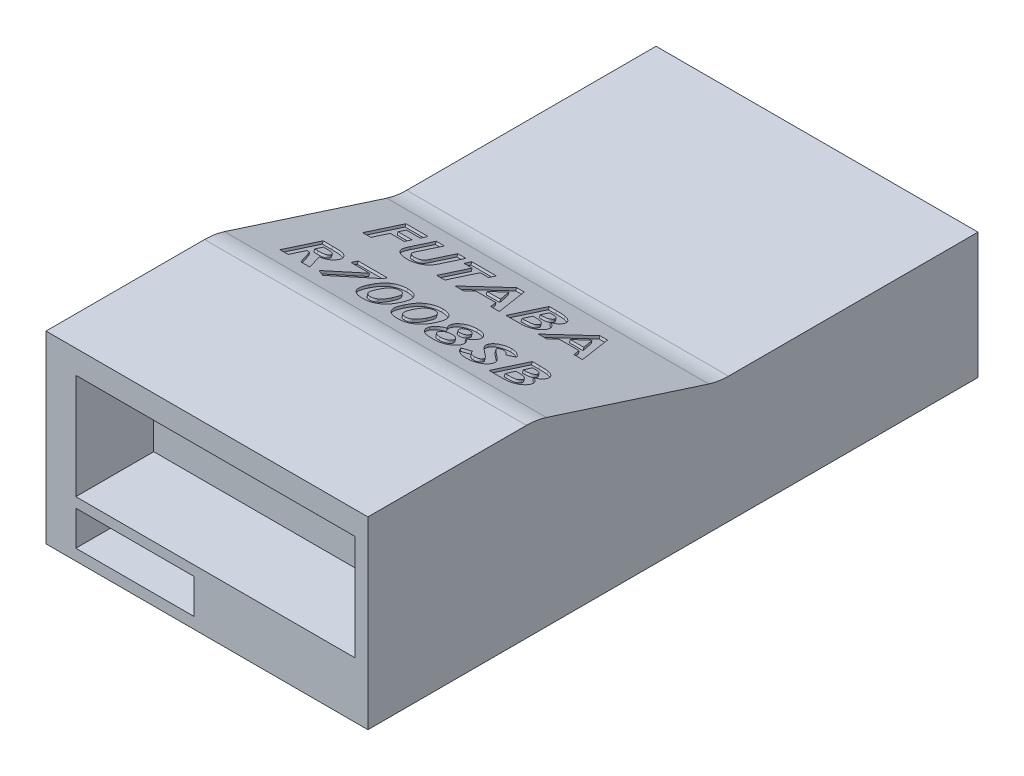
from build123d import *

# Parameters (mm, degrees)
EXTRUDE_1_DEPTH     = 12.4
SKETCH_2_W          = 21.5
SKETCH_2_H          = 8.1
SKETCH_2_W_2        = 9.1
SKETCH_2_H_2        = 2.67
CUT_EXTRUDE_1_DEPTH = 6
SKETCH_3_R          = 1.25
EXTRUDE_2_DEPTH     = 0.2
CUT_EXTRUDE_2_DEPTH = 0.2


with BuildPart() as part:
    # 草图1 → 凸台-拉伸1 (new, symmetric)
    with BuildSketch(Plane(origin=(0, 0, 0), x_dir=(0, 0, -1), z_dir=(1, 0, 0))):
        with BuildLine():
            Line((0, 0), (47, 0))
            Line((47, 0), (47, 9.7))
            Line((47, 9.7), (27.783823522, 9.7))
            ThreePointArc((27.783823522, 9.7), (27.00945734, 9.760328248), (26.25377762, 9.939857194))
            Line((26.25377762, 9.939857194), (13.74622238, 13.960142806))
            ThreePointArc((13.74622238, 13.960142806), (12.99054266, 14.139671752), (12.216176478, 14.2))
            Line((12.216176478, 14.2), (0, 14.2))
            Line((0, 14.2), (0, 0))
        make_face()
    extrude(amount=EXTRUDE_1_DEPTH, both=True)

    # 草图2 → 切除-拉伸1 (cut)
    with BuildSketch(Plane.XY):
        with Locations((0.65, 8.35)):
            Rectangle(SKETCH_2_W, SKETCH_2_H)
        with Locations((-5.55, 2.195)):
            Rectangle(SKETCH_2_W_2, SKETCH_2_H_2)
    extrude(amount=-CUT_EXTRUDE_1_DEPTH, mode=Mode.SUBTRACT)

    # 草图3 → 凸台-拉伸2 (add)
    with BuildSketch(Plane(origin=(0, 0, -47), x_dir=(-1, 0, 0), z_dir=(0, 0, -1))):
        with Locations(Location((7.4, 6.9, 0), (0, 0, 180))):
            Circle(SKETCH_3_R)
        with Locations(Location((1.4, 6.9, 0), (0, 0, 180))):
            Circle(SKETCH_3_R)
    extrude(amount=EXTRUDE_2_DEPTH)

    # 草图4 → 切除-拉伸2 (cut)
    # profile 1 of 13: a face of its own
    with BuildSketch(Plane(origin=(0, 16.657572254, -5.354219653), x_dir=(1, 0, 0), z_dir=(0, 0.9520285612852643, -0.30600918041312064))):
        Polygon((-9.496153846, 20.452658583), (-7.791025641, 20.452658583), (-7.791025641, 19.824453454), (-8.867948718, 19.824453454), (-8.867948718, 19.151376531), (-7.791025641, 19.151376531), (-7.791025641, 18.523171403), (-8.867948718, 18.523171403), (-8.867948718, 16.952658583), (-9.496153846, 16.952658583), align=None)
    # profile 2 of 13: a face of its own
    with BuildSketch(Plane(origin=(0, 16.657572254, -5.354219653), x_dir=(1, 0, 0), z_dir=(0, 0.9520285612852643, -0.30600918041312064))):
        with BuildLine():
            Line((-7.162820513, 20.452658583), (-6.534615385, 20.452658583))
            Line((-6.534615385, 20.452658583), (-6.534615385, 18.175414993))
            add(Edge.make_bspline(
                [(-6.534615385, 18.175414993), (-6.534581226, 18.151805519), (-6.534515249, 18.106204064), (-6.531212397, 18.040780907), (-6.52819006, 17.980643327), (-6.522736907, 17.925857162), (-6.51468073, 17.876398978), (-6.506879722, 17.831951071), (-6.496321829, 17.793309232), (-6.480455004, 17.749324702), (-6.456009435, 17.699905681), (-6.416066732, 17.648400043), (-6.369976269, 17.601393673), (-6.314734195, 17.562267351), (-6.252646989, 17.530617683), (-6.184055793, 17.507168782), (-6.109057296, 17.494134307), (-6.05719995, 17.492144355), (-6.030508814, 17.491120121)],
                knots=[0, 0, 0, 0, 1.155499968, 2.231836252, 3.205919964, 4.102923608, 4.924856345, 5.658536265, 6.31071849, 6.882491295, 7.94666036, 8.992281882, 10.060072772, 11.158554251, 12.289267114, 13.461410017, 14.693379945, 16, 16, 16, 16], degree=3))
            add(Edge.make_bspline(
                [(-6.030508814, 17.491120121), (-6.002152777, 17.491947571), (-5.946863304, 17.493560958), (-5.8673382, 17.509398096), (-5.79365774, 17.534616243), (-5.72738199, 17.570608966), (-5.668576907, 17.613752553), (-5.618799636, 17.662949762), (-5.579515596, 17.718298717), (-5.553911721, 17.769362343), (-5.539536406, 17.816361964), (-5.528761391, 17.858354342), (-5.520862113, 17.907901191), (-5.513695629, 17.96422873), (-5.509389124, 18.027920405), (-5.504719421, 18.098463999), (-5.503007932, 18.176342189), (-5.502716221, 18.230570234), (-5.502564103, 18.258848486)],
                knots=[0, 0, 0, 0, 1.261321664, 2.459363699, 3.594844139, 4.716940403, 5.803436589, 6.833651888, 7.818396249, 8.814403945, 9.360733334, 10.004355033, 10.743453831, 11.592799886, 12.532235708, 13.585170094, 14.740740724, 16, 16, 16, 16], degree=3))
            Line((-5.502564103, 18.258848486), (-5.502564103, 20.452658583))
            Line((-5.502564103, 20.452658583), (-4.874358974, 20.452658583))
            Line((-4.874358974, 20.452658583), (-4.874358974, 18.364717878))
            add(Edge.make_bspline(
                [(-4.874358974, 18.364717878), (-4.874446212, 18.322416299), (-4.874613962, 18.241074488), (-4.87719009, 18.124180582), (-4.8826742, 18.017416749), (-4.88728022, 17.920751794), (-4.896194447, 17.83431594), (-4.90548098, 17.757740081), (-4.917317464, 17.691295585), (-4.934929442, 17.6156566), (-4.965322502, 17.52856108), (-5.0143201, 17.428274365), (-5.076519378, 17.330087595), (-5.150035817, 17.235080894), (-5.2330426, 17.146822731), (-5.323699292, 17.069343487), (-5.420565581, 17.003804402), (-5.524653651, 16.951807985), (-5.635874918, 16.9112547), (-5.755329833, 16.884004934), (-5.882936937, 16.865594651), (-5.971077576, 16.863826117), (-6.016486378, 16.862914993)],
                knots=[0, 0, 0, 0, 1.170808336, 2.251350247, 3.235597562, 4.129743112, 4.929140599, 5.639994148, 6.264258765, 6.79612947, 7.788252245, 8.809469599, 9.879094798, 10.999557536, 12.129761673, 13.226370002, 14.293821979, 15.358369427, 16.438775801, 17.562147481, 18.744053101, 20, 20, 20, 20], degree=3))
            add(Edge.make_bspline(
                [(-6.016486378, 16.862914993), (-6.04665689, 16.863423175), (-6.10618269, 16.864425809), (-6.193725821, 16.873266417), (-6.278353455, 16.88629415), (-6.359906575, 16.90530027), (-6.438668239, 16.929852627), (-6.51461752, 16.960074869), (-6.587472173, 16.99579842), (-6.656824513, 17.0366947), (-6.722589197, 17.080916987), (-6.782694723, 17.129939254), (-6.839209464, 17.180136119), (-6.890500733, 17.233620079), (-6.936953772, 17.289829643), (-6.978472911, 17.348892202), (-7.014996468, 17.410802508), (-7.047443171, 17.476676492), (-7.075214382, 17.549862291), (-7.098626556, 17.632963152), (-7.119079982, 17.7272816), (-7.134279762, 17.833030128), (-7.148059971, 17.949860202), (-7.156782084, 18.078076182), (-7.161345014, 18.217681745), (-7.162316252, 18.314467388), (-7.162820513, 18.364717878)],
                knots=[0, 0, 0, 0, 1.001158378, 1.975264943, 2.917723546, 3.841610987, 4.75185031, 5.653588123, 6.552117133, 7.442167995, 8.324307438, 9.179605724, 10.014504199, 10.831958861, 11.636465792, 12.43274043, 13.225645099, 14.020104002, 14.867201867, 15.819789774, 16.883317127, 18.068162734, 19.364263498, 20.787406516, 22.332041935, 24, 24, 24, 24], degree=3))
            Line((-7.162820513, 18.364717878), (-7.162820513, 20.452658583))
        make_face()
    # profile 3 of 13: a face of its own
    with BuildSketch(Plane(origin=(0, 16.657572254, -5.354219653), x_dir=(1, 0, 0), z_dir=(0, 0.9520285612852643, -0.30600918041312064))):
        Polygon((-4.425641026, 20.452658583), (-2.541025641, 20.452658583), (-2.541025641, 19.824453454), (-3.169230769, 19.824453454), (-3.169230769, 16.952658583), (-3.797435897, 16.952658583), (-3.797435897, 19.824453454), (-4.425641026, 19.824453454), align=None)
    # profile 4 of 13: a face of its own
    with BuildSketch(Plane(origin=(0, 16.657572254, -5.354219653), x_dir=(1, 0, 0), z_dir=(0, 0.9520285612852643, -0.30600918041312064))):
        Polygon((-0.969811699, 20.452658583), (-0.387179487, 20.452658583), (1.026282051, 16.952658583), (0.355308494, 16.952658583), (0.083273237, 17.670607301), (-1.441666667, 17.670607301), (-1.713701923, 16.952658583), (-2.383974359, 16.952658583), align=None)
        Polygon((-0.678846154, 19.513856499), (-1.203285256, 18.298812429), (-0.154407051, 18.298812429), align=None, mode=Mode.SUBTRACT)
    # profile 5 of 13: a face of its own
    with BuildSketch(Plane(origin=(0, 16.657572254, -5.354219653), x_dir=(1, 0, 0), z_dir=(0, 0.9520285612852643, -0.30600918041312064))):
        with BuildLine():
            Line((1.542307692, 16.952658583), (1.542307692, 20.452658583))
            Line((1.542307692, 20.452658583), (2.103205128, 20.452658583))
            add(Edge.make_bspline(
                [(2.103205128, 20.452658583), (2.142471456, 20.452663064), (2.218451055, 20.452671735), (2.328069789, 20.448822285), (2.429731906, 20.44384259), (2.52311388, 20.43827147), (2.608374652, 20.428671316), (2.68538457, 20.418553802), (2.7542975, 20.406352705), (2.796902619, 20.395407942), (2.816947115, 20.390258743)],
                knots=[0, 0, 0, 0, 1.311965854, 2.538629056, 3.664479157, 4.713267157, 5.663616078, 6.530575999, 7.308677837, 8, 8, 8, 8], degree=3))
            add(Edge.make_bspline(
                [(2.816947115, 20.390258743), (2.843267574, 20.382995706), (2.894916763, 20.368743295), (2.968894884, 20.339959936), (3.039073451, 20.307965191), (3.105366778, 20.271465171), (3.167367798, 20.230019219), (3.224840886, 20.183298406), (3.279025593, 20.133178105), (3.327997945, 20.078261477), (3.372260882, 20.020231886), (3.410717439, 19.959104539), (3.444131258, 19.895814112), (3.470871065, 19.829564136), (3.491019007, 19.760659713), (3.505755128, 19.689395073), (3.51530613, 19.615544717), (3.516208574, 19.565301907), (3.516666667, 19.539798006)],
                knots=[0, 0, 0, 0, 1.099996261, 2.158545794, 3.195537121, 4.207578794, 5.205712374, 6.197378256, 7.190519799, 8.17788031, 9.159561366, 10.129234751, 11.085776129, 12.040971148, 13.00380137, 13.975669004, 14.972423361, 16, 16, 16, 16], degree=3))
            add(Edge.make_bspline(
                [(3.516666667, 19.539798006), (3.515468891, 19.507032187), (3.513111217, 19.442536698), (3.498050232, 19.347804494), (3.469808541, 19.258268944), (3.432854973, 19.172279943), (3.382609676, 19.090158231), (3.318807865, 19.011942853), (3.242482921, 18.935225442), (3.183937477, 18.889238529), (3.153485577, 18.865318839)],
                knots=[0, 0, 0, 0, 0.986156485, 1.941127874, 2.875419072, 3.804401753, 4.751181392, 5.761612777, 6.835722519, 8, 8, 8, 8], degree=3))
            add(Edge.make_bspline(
                [(3.153485577, 18.865318839), (3.178162336, 18.852721568), (3.226546632, 18.828021804), (3.295238118, 18.787422766), (3.358838936, 18.74424054), (3.417634253, 18.699343969), (3.470390769, 18.650829824), (3.51928689, 18.601493555), (3.561910334, 18.548508401), (3.600025503, 18.493762852), (3.633154588, 18.436464186), (3.662006368, 18.376709169), (3.686376432, 18.314293664), (3.707013632, 18.249535315), (3.722404862, 18.182211385), (3.73244027, 18.112297795), (3.740124007, 18.040032985), (3.740721729, 17.990808002), (3.741025641, 17.965779576)],
                knots=[0, 0, 0, 0, 1.164658916, 2.283573913, 3.35186032, 4.395461096, 5.390182219, 6.362969632, 7.312859996, 8.245001507, 9.165155236, 10.092416118, 11.032087915, 11.979892451, 12.947605196, 13.931445124, 14.948243989, 16, 16, 16, 16], degree=3))
            add(Edge.make_bspline(
                [(3.741025641, 17.965779576), (3.739053457, 17.917976714), (3.735161359, 17.823637957), (3.706704238, 17.685126996), (3.657368633, 17.553806041), (3.591121088, 17.43019702), (3.509491367, 17.317878209), (3.415640597, 17.219487906), (3.310513639, 17.136202699), (3.213521314, 17.079991645), (3.129630591, 17.042268772), (3.060145473, 17.018946112), (2.985519929, 16.997340036), (2.904386998, 16.982167803), (2.81821751, 16.968280507), (2.726171307, 16.959706203), (2.628420421, 16.953895608), (2.561280887, 16.953079261), (2.526682692, 16.952658583)],
                knots=[0, 0, 0, 0, 1.284142165, 2.534249414, 3.780121997, 5.041676246, 6.291546858, 7.49970053, 8.684500223, 9.883330709, 10.50184324, 11.153274765, 11.851151195, 12.587658647, 13.369265475, 14.195992086, 15.070362669, 16, 16, 16, 16], degree=3))
            Line((2.526682692, 16.952658583), (1.542307692, 16.952658583))
        make_face()
        with BuildLine():
            Line((2.170512821, 19.824453454), (2.170512821, 19.061632942))
            Line((2.170512821, 19.061632942), (2.337379808, 19.061632942))
            add(Edge.make_bspline(
                [(2.337379808, 19.061632942), (2.36005853, 19.061830709), (2.403838432, 19.062212486), (2.467073857, 19.067129645), (2.525872589, 19.075518624), (2.580011619, 19.08722336), (2.629995271, 19.102086668), (2.675504234, 19.119970429), (2.716338415, 19.141790561), (2.763778289, 19.17429261), (2.813925657, 19.222120831), (2.858069821, 19.291218605), (2.884070439, 19.370680783), (2.886966206, 19.426723663), (2.888461538, 19.45566339)],
                knots=[0, 0, 0, 0, 1.065314748, 2.056525647, 2.977365736, 3.853934255, 4.656397591, 5.425096493, 6.14721249, 6.826394842, 8.123232004, 9.372140726, 10.643011755, 12, 12, 12, 12], degree=3))
            add(Edge.make_bspline(
                [(2.888461538, 19.45566339), (2.887264999, 19.482770253), (2.884951538, 19.535180283), (2.858772259, 19.608768632), (2.818110663, 19.67398297), (2.770103934, 19.718616851), (2.724896269, 19.749100476), (2.686186693, 19.769172645), (2.643700027, 19.787141046), (2.596613773, 19.800880123), (2.545196822, 19.811189442), (2.489698932, 19.818760403), (2.430024352, 19.823913521), (2.388806993, 19.824269616), (2.367528045, 19.824453454)],
                knots=[0, 0, 0, 0, 1.347982417, 2.606269829, 3.849316587, 5.153353503, 5.842674298, 6.568177932, 7.326619318, 8.142485038, 9.012069166, 9.942760135, 10.937925643, 12, 12, 12, 12], degree=3))
            Line((2.367528045, 19.824453454), (2.170512821, 19.824453454))
        make_face(mode=Mode.SUBTRACT)
        with BuildLine():
            Line((2.170512821, 18.478299608), (2.170512821, 17.580863711))
            Line((2.170512821, 17.580863711), (2.351402244, 17.580863711))
            add(Edge.make_bspline(
                [(2.351402244, 17.580863711), (2.387164313, 17.581068018), (2.455921354, 17.581460825), (2.554415693, 17.58620686), (2.64397167, 17.594760753), (2.724351997, 17.6054396), (2.795679791, 17.619907766), (2.857713947, 17.638302186), (2.911305182, 17.658539251), (2.956132162, 17.68353443), (2.992753236, 17.712622619), (3.025799917, 17.742351448), (3.05274412, 17.77664646), (3.074062877, 17.814035466), (3.092514224, 17.853589696), (3.103642773, 17.896853729), (3.112115659, 17.942545323), (3.112581945, 17.97414921), (3.112820513, 17.990318839)],
                knots=[0, 0, 0, 0, 1.753078804, 3.370512758, 4.83203934, 6.162291463, 7.344201807, 8.395507345, 9.331626367, 10.147333109, 10.898971645, 11.62040215, 12.321813352, 13.025280112, 13.727906689, 14.453419512, 15.208716525, 16, 16, 16, 16], degree=3))
            add(Edge.make_bspline(
                [(3.112820513, 17.990318839), (3.112294403, 18.008809065), (3.111269681, 18.04482305), (3.102900771, 18.097461333), (3.087691728, 18.146602663), (3.068535196, 18.19350365), (3.041877864, 18.236485075), (3.010196535, 18.277034362), (2.971917403, 18.313778388), (2.928870285, 18.348939567), (2.878660084, 18.379725085), (2.821263243, 18.406436975), (2.756367951, 18.428745761), (2.683773187, 18.446508032), (2.603797202, 18.461582625), (2.515856259, 18.470583821), (2.42068276, 18.477278407), (2.354687907, 18.477951473), (2.320552885, 18.478299608)],
                knots=[0, 0, 0, 0, 0.845221588, 1.646264278, 2.427170338, 3.19324141, 3.95557735, 4.731569926, 5.540061037, 6.376114724, 7.268642756, 8.224665384, 9.265483498, 10.400594375, 11.639216012, 12.983232105, 14.439614077, 16, 16, 16, 16], degree=3))
            Line((2.320552885, 18.478299608), (2.170512821, 18.478299608))
        make_face(mode=Mode.SUBTRACT)
    # profile 6 of 13: a face of its own
    with BuildSketch(Plane(origin=(0, 16.657572254, -5.354219653), x_dir=(1, 0, 0), z_dir=(0, 0.9520285612852643, -0.30600918041312064))):
        Polygon((5.446854968, 20.452658583), (6.029487179, 20.452658583), (7.442948718, 16.952658583), (6.77197516, 16.952658583), (6.499939904, 17.670607301), (4.975, 17.670607301), (4.702964744, 16.952658583), (4.032692308, 16.952658583), align=None)
        Polygon((5.737820513, 19.513856499), (5.21338141, 18.298812429), (6.262259615, 18.298812429), align=None, mode=Mode.SUBTRACT)
    # profile 7 of 13: a face of its own
    with BuildSketch(Plane(origin=(0, 16.657572254, -5.354219653), x_dir=(1, 0, 0), z_dir=(0, 0.9520285612852643, -0.30600918041312064))):
        with BuildLine():
            Line((-9.496153846, 13.753940634), (-8.764182692, 13.753940634))
            add(Edge.make_bspline(
                [(-8.764182692, 13.753940634), (-8.715799622, 13.753768902), (-8.622745349, 13.753438613), (-8.488566169, 13.748227523), (-8.36530414, 13.740975864), (-8.252776761, 13.72990964), (-8.151032173, 13.715237164), (-8.059968404, 13.697940743), (-7.979588115, 13.678227764), (-7.909213411, 13.653663836), (-7.845703721, 13.625956097), (-7.786503859, 13.594119398), (-7.730307791, 13.558508249), (-7.677491125, 13.518185625), (-7.627594872, 13.47387692), (-7.5805249, 13.425537533), (-7.536946351, 13.372757566), (-7.497129066, 13.315870521), (-7.460838815, 13.256026654), (-7.428765845, 13.193143799), (-7.402684052, 13.127178226), (-7.379637993, 13.059083279), (-7.363038663, 12.987885528), (-7.351494071, 12.914278095), (-7.343041573, 12.838001874), (-7.342555595, 12.786183196), (-7.342307692, 12.759749929)],
                knots=[0, 0, 0, 0, 1.749336639, 3.364467119, 4.854658419, 6.213483162, 7.451590619, 8.570285859, 9.5643256, 10.440900261, 11.26203566, 12.067320669, 12.869050712, 13.665104639, 14.467235401, 15.27997916, 16.102287765, 16.939272006, 17.78853747, 18.631303466, 19.488103222, 20.351255419, 21.228522269, 22.127379805, 23.044756219, 24, 24, 24, 24], degree=3))
            add(Edge.make_bspline(
                [(-7.342307692, 12.759749929), (-7.342951654, 12.73215967), (-7.344214347, 12.678060202), (-7.351015895, 12.598592495), (-7.36344699, 12.522563351), (-7.38227569, 12.450195375), (-7.403916836, 12.380587863), (-7.432694008, 12.315025116), (-7.465171892, 12.25255362), (-7.503744925, 12.194057058), (-7.546076944, 12.138236103), (-7.595308193, 12.087229465), (-7.648249241, 12.038295728), (-7.707876098, 11.994499937), (-7.771560358, 11.952880779), (-7.840567358, 11.915162737), (-7.914446736, 11.880397669), (-7.966387598, 11.861010265), (-7.992948718, 11.851096083)],
                knots=[0, 0, 0, 0, 1.099860209, 2.156625411, 3.176576793, 4.16617041, 5.135385252, 6.078461593, 7.016046972, 7.938469504, 8.868247731, 9.803980173, 10.76021508, 11.73834243, 12.748633912, 13.790971185, 14.870363756, 16, 16, 16, 16], degree=3))
            Line((-7.992948718, 11.851096083), (-7.18525641, 10.253940634))
            Line((-7.18525641, 10.253940634), (-7.883573718, 10.253940634))
            Line((-7.883573718, 10.253940634), (-8.654807692, 11.77958166))
            Line((-8.654807692, 11.77958166), (-8.867948718, 11.77958166))
            Line((-8.867948718, 11.77958166), (-8.867948718, 10.253940634))
            Line((-8.867948718, 10.253940634), (-9.496153846, 10.253940634))
            Line((-9.496153846, 10.253940634), (-9.496153846, 13.753940634))
        make_face()
        with BuildLine():
            Line((-8.867948718, 12.407786788), (-8.623257212, 12.407786788))
            add(Edge.make_bspline(
                [(-8.623257212, 12.407786788), (-8.593341641, 12.408123717), (-8.536059751, 12.408768864), (-8.45368087, 12.411761324), (-8.3788612, 12.418971674), (-8.31127944, 12.428081681), (-8.250595524, 12.4386005), (-8.197350732, 12.453674606), (-8.150724642, 12.469826892), (-8.111269776, 12.489899994), (-8.077560445, 12.512727465), (-8.048454596, 12.538660039), (-8.024379885, 12.568673692), (-8.004565169, 12.601952781), (-7.989151475, 12.638791653), (-7.97790066, 12.678785899), (-7.971613117, 12.722391106), (-7.970889714, 12.752484636), (-7.970512821, 12.76816339)],
                knots=[0, 0, 0, 0, 1.688639943, 3.233382647, 4.650958383, 5.928841754, 7.082724185, 8.122798841, 9.049171256, 9.863274652, 10.613301712, 11.341792392, 12.054588806, 12.776240173, 13.521029143, 14.301969904, 15.115324896, 16, 16, 16, 16], degree=3))
            add(Edge.make_bspline(
                [(-7.970512821, 12.76816339), (-7.971225372, 12.786712501), (-7.972625049, 12.823148793), (-7.986514186, 12.875604277), (-8.008622693, 12.924155416), (-8.0389274, 12.968582844), (-8.077092239, 13.007530994), (-8.120889403, 13.041864099), (-8.17126414, 13.06901215), (-8.217907356, 13.086918715), (-8.26034178, 13.097632397), (-8.298637509, 13.105616139), (-8.342984193, 13.111274446), (-8.393415313, 13.117276087), (-8.449802317, 13.121167848), (-8.512452548, 13.124008057), (-8.581186076, 13.125170127), (-8.629099873, 13.12554162), (-8.654106571, 13.125735506)],
                knots=[0, 0, 0, 0, 1.020303359, 2.004196876, 2.966617323, 3.9489082, 4.950758222, 5.960522915, 7.003732012, 8.091992268, 8.70421221, 9.413913587, 10.24622431, 11.166358409, 12.212345909, 13.359657661, 14.621978493, 16, 16, 16, 16], degree=3))
            Line((-8.654106571, 13.125735506), (-8.867948718, 13.125735506))
            Line((-8.867948718, 13.125735506), (-8.867948718, 12.407786788))
        make_face(mode=Mode.SUBTRACT)
    # profile 8 of 13: a face of its own
    with BuildSketch(Plane(origin=(0, 16.657572254, -5.354219653), x_dir=(1, 0, 0), z_dir=(0, 0.9520285612852643, -0.30600918041312064))):
        Polygon((-6.803846154, 13.753940634), (-4.56025641, 13.753940634), (-4.56025641, 13.427918999), (-6.104126603, 10.164197044), (-6.660817308, 10.444645762), (-5.370753205, 13.170607301), (-6.803846154, 13.170607301), align=None)
    # profile 9 of 13: a face of its own
    with BuildSketch(Plane(origin=(0, 16.657572254, -5.354219653), x_dir=(1, 0, 0), z_dir=(0, 0.9520285612852643, -0.30600918041312064))):
        with BuildLine():
            add(Edge.make_bspline(
                [(-3.067568109, 13.843684224), (-3.037160373, 13.843232812), (-2.977370641, 13.842345217), (-2.889311619, 13.832731835), (-2.804486435, 13.818208697), (-2.722563241, 13.797953983), (-2.644131729, 13.771147591), (-2.568621058, 13.739060799), (-2.496930023, 13.700010589), (-2.428144335, 13.655901372), (-2.36229049, 13.605963484), (-2.30095124, 13.549031714), (-2.243006398, 13.486416064), (-2.189710259, 13.417169897), (-2.139882561, 13.341923081), (-2.093687031, 13.260663683), (-2.051477308, 13.172993995), (-2.01278032, 13.078755808), (-1.978177351, 12.976536533), (-1.949031313, 12.865163671), (-1.924033709, 12.744611787), (-1.902933967, 12.61458081), (-1.886985972, 12.474897898), (-1.876236703, 12.325655848), (-1.868860045, 12.167142378), (-1.868258014, 12.05840344), (-1.867948718, 12.00253839)],
                knots=[0, 0, 0, 0, 0.879237366, 1.728815576, 2.559023295, 3.367336655, 4.166867292, 4.954216142, 5.737608147, 6.525189134, 7.316157332, 8.124696809, 8.942788509, 9.781158001, 10.649253743, 11.551476218, 12.482711956, 13.461909668, 14.496590415, 15.601789533, 16.789733467, 18.056700938, 19.410929216, 20.8549011, 22.384193279, 24, 24, 24, 24], degree=3))
            add(Edge.make_bspline(
                [(-1.867948718, 12.00253839), (-1.868282983, 11.945974406), (-1.868932455, 11.836071599), (-1.875930053, 11.676108284), (-1.887980247, 11.525782648), (-1.903511408, 11.385110242), (-1.924784849, 11.254165353), (-1.949699006, 11.132608923), (-1.979305105, 11.020485011), (-2.015047885, 10.918046259), (-2.053510639, 10.823642569), (-2.095835825, 10.736143815), (-2.141285719, 10.655313003), (-2.188817839, 10.579930689), (-2.241038071, 10.512219105), (-2.295404707, 10.449875705), (-2.35428497, 10.395275227), (-2.415199772, 10.345603809), (-2.480380668, 10.302677736), (-2.549155466, 10.2651353), (-2.6227503, 10.234683925), (-2.699823662, 10.208198946), (-2.781689283, 10.189185588), (-2.867046329, 10.174099114), (-2.956858464, 10.165761403), (-3.018006184, 10.164727055), (-3.049338942, 10.164197044)],
                knots=[0, 0, 0, 0, 1.643780988, 3.193836972, 4.651895693, 6.025988579, 7.305620092, 8.505800249, 9.631074763, 10.672816429, 11.65661981, 12.592235626, 13.49536222, 14.350718032, 15.179365177, 15.97804903, 16.751647189, 17.51006938, 18.259804725, 19.016521909, 19.783502495, 20.571750527, 21.382245291, 22.22305063, 23.089471752, 24, 24, 24, 24], degree=3))
            add(Edge.make_bspline(
                [(-3.049338942, 10.164197044), (-3.080670855, 10.164737279), (-3.142049612, 10.165795591), (-3.232104608, 10.17403712), (-3.317914004, 10.189246704), (-3.400427314, 10.208344916), (-3.479070257, 10.234625324), (-3.554219925, 10.265987782), (-3.625298482, 10.303295972), (-3.692502733, 10.346322059), (-3.755603224, 10.395661138), (-3.815580535, 10.450785472), (-3.872301994, 10.511555335), (-3.924904727, 10.578651399), (-3.974250214, 10.651178073), (-4.019823859, 10.729963575), (-4.061598275, 10.814893195), (-4.100880172, 10.906085318), (-4.135011168, 11.005503204), (-4.16538617, 11.114034643), (-4.190268572, 11.232584334), (-4.210280665, 11.361114191), (-4.226258309, 11.499351919), (-4.238143839, 11.64736424), (-4.245180306, 11.805220096), (-4.245822966, 11.913722288), (-4.246153846, 11.969585666)],
                knots=[0, 0, 0, 0, 0.917216111, 1.796812873, 2.643793957, 3.46689424, 4.273913431, 5.068098542, 5.848489301, 6.620921603, 7.401012384, 8.190319798, 9.003608147, 9.831726257, 10.68377682, 11.569763213, 12.493818149, 13.453288342, 14.474581811, 15.568529029, 16.750744269, 18.018426408, 19.375425659, 20.823733699, 22.36466933, 24, 24, 24, 24], degree=3))
            add(Edge.make_bspline(
                [(-4.246153846, 11.969585666), (-4.245554488, 12.047203431), (-4.24439802, 12.196967909), (-4.229742399, 12.413334036), (-4.208231666, 12.61332704), (-4.176637494, 12.796612382), (-4.137571737, 12.963868899), (-4.087546001, 13.11399479), (-4.030595339, 13.249067386), (-3.98206606, 13.329085205), (-3.95869391, 13.367622525)],
                knots=[0, 0, 0, 0, 1.288568992, 2.486310467, 3.599230591, 4.627010532, 5.572937695, 6.447898582, 7.252493626, 8, 8, 8, 8], degree=3))
            add(Edge.make_bspline(
                [(-3.95869391, 13.367622525), (-3.931517888, 13.405481576), (-3.87838341, 13.479503482), (-3.785476291, 13.576680408), (-3.685659687, 13.659790873), (-3.576883423, 13.726954014), (-3.46086784, 13.779918872), (-3.336616887, 13.817327355), (-3.2045894, 13.839123281), (-3.113923923, 13.842141206), (-3.067568109, 13.843684224)],
                knots=[0, 0, 0, 0, 1.058512271, 2.069600068, 3.047294572, 4.004278952, 4.967380941, 5.939006123, 6.946246673, 8, 8, 8, 8], degree=3))
        make_face()
        with BuildLine():
            add(Edge.make_bspline(
                [(-3.052143429, 13.215479095), (-3.079632275, 13.214176179), (-3.133525003, 13.211621771), (-3.21172592, 13.189938449), (-3.285464501, 13.15644739), (-3.341555471, 13.116146137), (-3.383539004, 13.077512552), (-3.4128732, 13.042550415), (-3.441161408, 13.003535189), (-3.466146978, 12.958706319), (-3.489739878, 12.909674558), (-3.512797253, 12.856217332), (-3.531698246, 12.797021615), (-3.55026797, 12.733095519), (-3.566536782, 12.662671656), (-3.580166479, 12.58517439), (-3.592343416, 12.500099748), (-3.600836974, 12.407392006), (-3.608755519, 12.30714816), (-3.614431908, 12.199144905), (-3.616805063, 12.083411377), (-3.617559417, 12.003707415), (-3.617948718, 11.962574448)],
                knots=[0, 0, 0, 0, 1.076674018, 2.110852608, 3.161083442, 4.239746716, 4.804137807, 5.395870207, 6.026861976, 6.692161227, 7.405688833, 8.16177676, 8.973626916, 9.841385931, 10.773283133, 11.807421078, 12.927755683, 14.143907515, 15.458935494, 16.872852025, 18.386167141, 20, 20, 20, 20], degree=3))
            add(Edge.make_bspline(
                [(-3.617948718, 11.962574448), (-3.617307976, 11.909284701), (-3.616079306, 11.80709766), (-3.609644107, 11.660149137), (-3.596745284, 11.526414149), (-3.580701753, 11.404986323), (-3.558167959, 11.296653152), (-3.53224137, 11.200389704), (-3.500224338, 11.117423104), (-3.463222488, 11.046553468), (-3.422241272, 10.986264815), (-3.377754359, 10.935019189), (-3.331276369, 10.890642895), (-3.281356574, 10.854596578), (-3.228114066, 10.826972342), (-3.171993323, 10.80710257), (-3.112958681, 10.794939456), (-3.072532367, 10.793252823), (-3.052143429, 10.792402172)],
                knots=[0, 0, 0, 0, 1.771748488, 3.397459088, 4.888034009, 6.237357457, 7.467047327, 8.564189669, 9.548206622, 10.417051504, 11.216568818, 11.965764335, 12.669334354, 13.348544111, 14.005342236, 14.656555988, 15.322436492, 16, 16, 16, 16], degree=3))
            add(Edge.make_bspline(
                [(-3.052143429, 10.792402172), (-3.032454176, 10.79298425), (-2.993905066, 10.794123887), (-2.937691831, 10.805822103), (-2.884532601, 10.824840861), (-2.834587881, 10.851744229), (-2.787679026, 10.885955978), (-2.744035297, 10.927626449), (-2.703985846, 10.977171), (-2.680652855, 11.013940383), (-2.668629808, 11.032886948)],
                knots=[0, 0, 0, 0, 0.992283464, 1.942767638, 2.88273346, 3.832339453, 4.79467288, 5.803907806, 6.868395428, 8, 8, 8, 8], degree=3))
            add(Edge.make_bspline(
                [(-2.668629808, 11.032886948), (-2.654474695, 11.058776823), (-2.62479257, 11.113065791), (-2.590444365, 11.204676401), (-2.56153196, 11.307998028), (-2.536647476, 11.423352219), (-2.519628007, 11.551193944), (-2.50497086, 11.690712549), (-2.497901355, 11.842610592), (-2.496751461, 11.947846104), (-2.496153846, 12.00253839)],
                knots=[0, 0, 0, 0, 0.710965849, 1.490837728, 2.352621235, 3.297892224, 4.334225155, 5.461620853, 6.680770821, 8, 8, 8, 8], degree=3))
            add(Edge.make_bspline(
                [(-2.496153846, 12.00253839), (-2.496384692, 12.057705432), (-2.49682903, 12.163892569), (-2.504981357, 12.316336697), (-2.516334096, 12.455569107), (-2.532939874, 12.58127895), (-2.554306227, 12.693771395), (-2.580640337, 12.793039088), (-2.611686293, 12.879277667), (-2.648503098, 12.952401139), (-2.689279997, 13.014546059), (-2.73256592, 13.067861581), (-2.778543897, 13.113381028), (-2.827137039, 13.151275698), (-2.879470051, 13.180230069), (-2.934543304, 13.200674249), (-2.992469701, 13.213042293), (-3.031983705, 13.214655864), (-3.052143429, 13.215479095)],
                knots=[0, 0, 0, 0, 1.793836731, 3.452829483, 4.963243077, 6.335886805, 7.574563692, 8.684454726, 9.672768357, 10.54971625, 11.340229787, 12.085688095, 12.778991901, 13.440269426, 14.083255152, 14.715733572, 15.344777694, 16, 16, 16, 16], degree=3))
        make_face(mode=Mode.SUBTRACT)
    # profile 10 of 13: a face of its own
    with BuildSketch(Plane(origin=(0, 16.657572254, -5.354219653), x_dir=(1, 0, 0), z_dir=(0, 0.9520285612852643, -0.30600918041312064))):
        with BuildLine():
            add(Edge.make_bspline(
                [(-0.375260417, 13.843684224), (-0.344852681, 13.843232812), (-0.285062949, 13.842345217), (-0.197003927, 13.832731835), (-0.112178743, 13.818208697), (-0.030255549, 13.797953983), (0.048175964, 13.771147591), (0.123686635, 13.739060799), (0.195377669, 13.700010589), (0.264163357, 13.655901372), (0.330017202, 13.605963484), (0.391356453, 13.549031714), (0.449301294, 13.486416064), (0.502597434, 13.417169897), (0.552425131, 13.341923081), (0.598620661, 13.260663683), (0.640830385, 13.172993995), (0.679527373, 13.078755808), (0.714130341, 12.976536533), (0.743276379, 12.865163671), (0.768273984, 12.744611787), (0.789373726, 12.61458081), (0.80532172, 12.474897898), (0.81607099, 12.325655848), (0.823447647, 12.167142378), (0.824049678, 12.05840344), (0.824358974, 12.00253839)],
                knots=[0, 0, 0, 0, 0.879237366, 1.728815576, 2.559023295, 3.367336655, 4.166867292, 4.954216142, 5.737608147, 6.525189134, 7.316157332, 8.124696809, 8.942788509, 9.781158001, 10.649253743, 11.551476218, 12.482711956, 13.461909668, 14.496590415, 15.601789533, 16.789733467, 18.056700938, 19.410929216, 20.8549011, 22.384193279, 24, 24, 24, 24], degree=3))
            add(Edge.make_bspline(
                [(0.824358974, 12.00253839), (0.824024709, 11.945974406), (0.823375237, 11.836071599), (0.816377639, 11.676108284), (0.804327445, 11.525782648), (0.788796284, 11.385110242), (0.767522843, 11.254165353), (0.742608686, 11.132608923), (0.713002587, 11.020485011), (0.677259807, 10.918046259), (0.638797053, 10.823642569), (0.596471868, 10.736143815), (0.551021973, 10.655313003), (0.503489853, 10.579930689), (0.451269622, 10.512219105), (0.396902985, 10.449875705), (0.338022722, 10.395275227), (0.277107921, 10.345603809), (0.211927024, 10.302677736), (0.143152227, 10.2651353), (0.069557393, 10.234683925), (-0.007515969, 10.208198946), (-0.08938159, 10.189185588), (-0.174738637, 10.174099114), (-0.264550772, 10.165761403), (-0.325698491, 10.164727055), (-0.35703125, 10.164197044)],
                knots=[0, 0, 0, 0, 1.643780988, 3.193836972, 4.651895693, 6.025988579, 7.305620092, 8.505800249, 9.631074763, 10.672816429, 11.65661981, 12.592235626, 13.49536222, 14.350718032, 15.179365177, 15.97804903, 16.751647189, 17.51006938, 18.259804725, 19.016521909, 19.783502495, 20.571750527, 21.382245291, 22.22305063, 23.089471752, 24, 24, 24, 24], degree=3))
            add(Edge.make_bspline(
                [(-0.35703125, 10.164197044), (-0.388363163, 10.164737279), (-0.44974192, 10.165795591), (-0.539796916, 10.17403712), (-0.625606312, 10.189246704), (-0.708119621, 10.208344916), (-0.786762565, 10.234625324), (-0.861912233, 10.265987782), (-0.93299079, 10.303295972), (-1.000195041, 10.346322059), (-1.063295532, 10.395661138), (-1.123272843, 10.450785472), (-1.179994302, 10.511555335), (-1.232597035, 10.578651399), (-1.281942521, 10.651178073), (-1.327516167, 10.729963575), (-1.369290582, 10.814893195), (-1.408572479, 10.906085318), (-1.442703475, 11.005503204), (-1.473078477, 11.114034643), (-1.49796088, 11.232584334), (-1.517972973, 11.361114191), (-1.533950617, 11.499351919), (-1.545836147, 11.64736424), (-1.552872614, 11.805220096), (-1.553515274, 11.913722288), (-1.553846154, 11.969585666)],
                knots=[0, 0, 0, 0, 0.917216111, 1.796812873, 2.643793957, 3.46689424, 4.273913431, 5.068098542, 5.848489301, 6.620921603, 7.401012384, 8.190319798, 9.003608147, 9.831726257, 10.68377682, 11.569763213, 12.493818149, 13.453288342, 14.474581811, 15.568529029, 16.750744269, 18.018426408, 19.375425659, 20.823733699, 22.36466933, 24, 24, 24, 24], degree=3))
            add(Edge.make_bspline(
                [(-1.553846154, 11.969585666), (-1.553246796, 12.047203431), (-1.552090327, 12.196967909), (-1.537434707, 12.413334036), (-1.515923973, 12.61332704), (-1.484329801, 12.796612382), (-1.445264044, 12.963868899), (-1.395238308, 13.11399479), (-1.338287647, 13.249067386), (-1.289758367, 13.329085205), (-1.266386218, 13.367622525)],
                knots=[0, 0, 0, 0, 1.288568992, 2.486310467, 3.599230591, 4.627010532, 5.572937695, 6.447898582, 7.252493626, 8, 8, 8, 8], degree=3))
            add(Edge.make_bspline(
                [(-1.266386218, 13.367622525), (-1.239210196, 13.405481576), (-1.186075718, 13.479503482), (-1.093168598, 13.576680408), (-0.993351994, 13.659790873), (-0.88457573, 13.726954014), (-0.768560148, 13.779918872), (-0.644309194, 13.817327355), (-0.512281708, 13.839123281), (-0.42161623, 13.842141206), (-0.375260417, 13.843684224)],
                knots=[0, 0, 0, 0, 1.058512271, 2.069600068, 3.047294572, 4.004278952, 4.967380941, 5.939006123, 6.946246673, 8, 8, 8, 8], degree=3))
        make_face()
        with BuildLine():
            add(Edge.make_bspline(
                [(-0.359835737, 13.215479095), (-0.387324582, 13.214176179), (-0.441217311, 13.211621771), (-0.519418227, 13.189938449), (-0.593156809, 13.15644739), (-0.649247779, 13.116146137), (-0.691231312, 13.077512552), (-0.720565507, 13.042550415), (-0.748853715, 13.003535189), (-0.773839285, 12.958706319), (-0.797432186, 12.909674558), (-0.820489561, 12.856217332), (-0.839390554, 12.797021615), (-0.857960278, 12.733095519), (-0.87422909, 12.662671656), (-0.887858787, 12.58517439), (-0.900035723, 12.500099748), (-0.908529282, 12.407392006), (-0.916447827, 12.30714816), (-0.922124215, 12.199144905), (-0.924497371, 12.083411377), (-0.925251725, 12.003707415), (-0.925641026, 11.962574448)],
                knots=[0, 0, 0, 0, 1.076674018, 2.110852608, 3.161083442, 4.239746716, 4.804137807, 5.395870207, 6.026861976, 6.692161227, 7.405688833, 8.16177676, 8.973626916, 9.841385931, 10.773283133, 11.807421078, 12.927755683, 14.143907515, 15.458935494, 16.872852025, 18.386167141, 20, 20, 20, 20], degree=3))
            add(Edge.make_bspline(
                [(-0.925641026, 11.962574448), (-0.925000284, 11.909284701), (-0.923771614, 11.80709766), (-0.917336415, 11.660149137), (-0.904437592, 11.526414149), (-0.888394061, 11.404986323), (-0.865860267, 11.296653152), (-0.839933678, 11.200389704), (-0.807916645, 11.117423104), (-0.770914795, 11.046553468), (-0.729933579, 10.986264815), (-0.685446666, 10.935019189), (-0.638968677, 10.890642895), (-0.589048882, 10.854596578), (-0.535806374, 10.826972342), (-0.479685631, 10.80710257), (-0.420650989, 10.794939456), (-0.380224674, 10.793252823), (-0.359835737, 10.792402172)],
                knots=[0, 0, 0, 0, 1.771748488, 3.397459088, 4.888034009, 6.237357457, 7.467047327, 8.564189669, 9.548206622, 10.417051504, 11.216568818, 11.965764335, 12.669334354, 13.348544111, 14.005342236, 14.656555988, 15.322436492, 16, 16, 16, 16], degree=3))
            add(Edge.make_bspline(
                [(-0.359835737, 10.792402172), (-0.340146484, 10.79298425), (-0.301597374, 10.794123887), (-0.245384138, 10.805822103), (-0.192224909, 10.824840861), (-0.142280189, 10.851744229), (-0.095371334, 10.885955978), (-0.051727605, 10.927626449), (-0.011678154, 10.977171), (0.011654837, 11.013940383), (0.023677885, 11.032886948)],
                knots=[0, 0, 0, 0, 0.992283464, 1.942767638, 2.88273346, 3.832339453, 4.79467288, 5.803907806, 6.868395428, 8, 8, 8, 8], degree=3))
            add(Edge.make_bspline(
                [(0.023677885, 11.032886948), (0.037832998, 11.058776823), (0.067515122, 11.113065791), (0.101863327, 11.204676401), (0.130775732, 11.307998028), (0.155660217, 11.423352219), (0.172679686, 11.551193944), (0.187336832, 11.690712549), (0.194406338, 11.842610592), (0.195556231, 11.947846104), (0.196153846, 12.00253839)],
                knots=[0, 0, 0, 0, 0.710965849, 1.490837728, 2.352621235, 3.297892224, 4.334225155, 5.461620853, 6.680770821, 8, 8, 8, 8], degree=3))
            add(Edge.make_bspline(
                [(0.196153846, 12.00253839), (0.195923, 12.057705432), (0.195478662, 12.163892569), (0.187326335, 12.316336697), (0.175973597, 12.455569107), (0.159367818, 12.58127895), (0.138001466, 12.693771395), (0.111667356, 12.793039088), (0.080621399, 12.879277667), (0.043804594, 12.952401139), (0.003027695, 13.014546059), (-0.040258228, 13.067861581), (-0.086236205, 13.113381028), (-0.134829347, 13.151275698), (-0.187162359, 13.180230069), (-0.242235611, 13.200674249), (-0.300162009, 13.213042293), (-0.339676013, 13.214655864), (-0.359835737, 13.215479095)],
                knots=[0, 0, 0, 0, 1.793836731, 3.452829483, 4.963243077, 6.335886805, 7.574563692, 8.684454726, 9.672768357, 10.54971625, 11.340229787, 12.085688095, 12.778991901, 13.440269426, 14.083255152, 14.715733572, 15.344777694, 16, 16, 16, 16], degree=3))
        make_face(mode=Mode.SUBTRACT)
    # profile 11 of 13: a face of its own
    with BuildSketch(Plane(origin=(0, 16.657572254, -5.354219653), x_dir=(1, 0, 0), z_dir=(0, 0.9520285612852643, -0.30600918041312064))):
        with BuildLine():
            add(Edge.make_bspline(
                [(3.037099359, 12.138556019), (3.073801267, 12.112331513), (3.146449384, 12.060422472), (3.242390971, 11.967425482), (3.325030126, 11.863686262), (3.393499047, 11.749841126), (3.448354281, 11.628688418), (3.487622306, 11.501523115), (3.512564905, 11.369466848), (3.515289381, 11.279559257), (3.516666667, 11.234108903)],
                knots=[0, 0, 0, 0, 1.013736912, 2.006600758, 2.994453809, 3.989973287, 4.987781207, 5.978959008, 6.978317308, 8, 8, 8, 8], degree=3))
            add(Edge.make_bspline(
                [(3.516666667, 11.234108903), (3.515005077, 11.184894169), (3.511709526, 11.087283062), (3.482572455, 10.944136387), (3.435794056, 10.806613717), (3.371862245, 10.676232953), (3.291703512, 10.55704583), (3.198271054, 10.451531261), (3.091447091, 10.362444939), (2.991990956, 10.302000445), (2.906385587, 10.26184831), (2.837302804, 10.236151749), (2.764355928, 10.213529524), (2.687024417, 10.195455866), (2.605322335, 10.181346411), (2.51936628, 10.172028553), (2.429099669, 10.165255037), (2.367541657, 10.164555655), (2.335977564, 10.164197044)],
                knots=[0, 0, 0, 0, 1.313679292, 2.605514271, 3.884962679, 5.186178731, 6.472827995, 7.711026938, 8.938935107, 10.174644318, 10.808706728, 11.462743532, 12.142127587, 12.847854939, 13.582806024, 14.355735269, 15.156897313, 16, 16, 16, 16], degree=3))
            add(Edge.make_bspline(
                [(2.335977564, 10.164197044), (2.30231759, 10.164653627), (2.236586297, 10.165545244), (2.140633251, 10.17093643), (2.050121182, 10.180875686), (1.964860226, 10.193959947), (1.884932412, 10.211274217), (1.810335374, 10.233227763), (1.740888988, 10.258224317), (1.655882964, 10.296283716), (1.558736493, 10.355721618), (1.453738726, 10.442766712), (1.361577551, 10.546440138), (1.281452137, 10.663831799), (1.218294265, 10.794219502), (1.17132819, 10.933510801), (1.143514324, 11.081328234), (1.140165845, 11.182575908), (1.138461538, 11.234108903)],
                knots=[0, 0, 0, 0, 0.886964665, 1.7320671, 2.531131818, 3.285397207, 4.004107883, 4.684213108, 5.332925796, 5.947568694, 7.135706876, 8.320776993, 9.52873045, 10.778999824, 12.05415135, 13.333578234, 14.642845846, 16, 16, 16, 16], degree=3))
            add(Edge.make_bspline(
                [(1.138461538, 11.234108903), (1.140018989, 11.279062964), (1.143079569, 11.367403137), (1.165002916, 11.49684943), (1.202594795, 11.619579832), (1.254176703, 11.736448742), (1.320690698, 11.847469164), (1.402530104, 11.951824206), (1.498657281, 12.050455297), (1.571552316, 12.108701996), (1.608914263, 12.138556019)],
                knots=[0, 0, 0, 0, 1.01821053, 2.000906977, 2.963938143, 3.919209931, 4.888045165, 5.887808425, 6.917407893, 8, 8, 8, 8], degree=3))
            add(Edge.make_bspline(
                [(1.608914263, 12.138556019), (1.585751838, 12.165270487), (1.540151998, 12.217863231), (1.481145357, 12.30250706), (1.431434746, 12.389774937), (1.389228071, 12.478958636), (1.358027821, 12.571593679), (1.33443324, 12.666223653), (1.321088167, 12.763812621), (1.319002292, 12.829590485), (1.317948718, 12.862814833)],
                knots=[0, 0, 0, 0, 1.061529281, 2.089831458, 3.092927091, 4.075998741, 5.048384512, 6.024008542, 7.00192825, 8, 8, 8, 8], degree=3))
            add(Edge.make_bspline(
                [(1.317948718, 12.862814833), (1.319345597, 12.907790805), (1.322101585, 12.996526666), (1.346511209, 13.126279446), (1.387037114, 13.249570448), (1.442169158, 13.366038694), (1.512178285, 13.473145884), (1.595364285, 13.56919709), (1.69289659, 13.650673994), (1.801148234, 13.720584774), (1.920661827, 13.77619116), (2.050303435, 13.815100344), (2.188507617, 13.839731909), (2.283753814, 13.842346744), (2.332471955, 13.843684224)],
                knots=[0, 0, 0, 0, 1.022455555, 2.017265428, 2.990720743, 3.968117071, 4.939886797, 5.893155559, 6.847550415, 7.820889576, 8.817530429, 9.83499769, 10.892607882, 12, 12, 12, 12], degree=3))
            add(Edge.make_bspline(
                [(2.332471955, 13.843684224), (2.380488428, 13.842344555), (2.474110495, 13.839732481), (2.609885924, 13.815264125), (2.736725952, 13.775488232), (2.853581705, 13.718707747), (2.960713816, 13.648662222), (3.056588485, 13.564348368), (3.139513445, 13.465904851), (3.210103693, 13.35602683), (3.266353273, 13.237649182), (3.307938389, 13.113505643), (3.331991711, 12.984571992), (3.335443314, 12.897032127), (3.337179487, 12.852999128)],
                knots=[0, 0, 0, 0, 1.094655142, 2.134348324, 3.136019022, 4.118575226, 5.088726318, 6.048298823, 7.020513804, 8.015920439, 9.020015034, 10.003048569, 10.995523219, 12, 12, 12, 12], degree=3))
            add(Edge.make_bspline(
                [(3.337179487, 12.852999128), (3.336343131, 12.821878985), (3.334701843, 12.760808031), (3.322566497, 12.67083328), (3.302132062, 12.584502386), (3.273641833, 12.499729086), (3.23403069, 12.414209617), (3.180427602, 12.32630527), (3.115226486, 12.232363602), (3.064020791, 12.1708807), (3.037099359, 12.138556019)],
                knots=[0, 0, 0, 0, 0.940746401, 1.846144481, 2.739104268, 3.619506754, 4.545839139, 5.581956076, 6.728711598, 8, 8, 8, 8], degree=3))
        make_face()
        with BuildLine():
            add(Edge.make_bspline(
                [(2.317047276, 13.215479095), (2.291182759, 13.214232186), (2.240870559, 13.211806673), (2.169080941, 13.189913726), (2.104539732, 13.154106254), (2.048720212, 13.104828126), (2.002945297, 13.0450365), (1.969303249, 12.976293808), (1.949353117, 12.899448411), (1.947241007, 12.845639808), (1.946153846, 12.817943038)],
                knots=[0, 0, 0, 0, 1.018099191, 1.980427864, 2.929421084, 3.909248076, 4.895556904, 5.880788387, 6.909183412, 8, 8, 8, 8], degree=3))
            add(Edge.make_bspline(
                [(1.946153846, 12.817943038), (1.947496822, 12.790009731), (1.950119112, 12.735467259), (1.97074048, 12.657145412), (2.005890171, 12.586163546), (2.054150458, 12.524004238), (2.112794523, 12.473234313), (2.178457898, 12.43445907), (2.251868803, 12.412323289), (2.302882336, 12.409321599), (2.328966346, 12.407786788)],
                knots=[0, 0, 0, 0, 1.07118507, 2.091592095, 3.082435519, 4.092579768, 5.090825648, 6.043203473, 6.999459622, 8, 8, 8, 8], degree=3))
            add(Edge.make_bspline(
                [(2.328966346, 12.407786788), (2.355543488, 12.408976003), (2.407320746, 12.411292817), (2.480914948, 12.43400296), (2.547213919, 12.470323204), (2.603989191, 12.521671994), (2.651016559, 12.583853814), (2.685265504, 12.656076151), (2.70497796, 12.736982041), (2.707609642, 12.793527831), (2.708974359, 12.82285089)],
                knots=[0, 0, 0, 0, 1.008803858, 1.965339183, 2.900766489, 3.864508618, 4.855158575, 5.849593072, 6.884859315, 8, 8, 8, 8], degree=3))
            add(Edge.make_bspline(
                [(2.708974359, 12.82285089), (2.707575121, 12.850529351), (2.704869042, 12.904058521), (2.685465427, 12.980908903), (2.649829718, 13.048578686), (2.603008992, 13.107999018), (2.544308351, 13.15591782), (2.476161206, 13.191157596), (2.399069364, 13.211597008), (2.344980037, 13.214157044), (2.317047276, 13.215479095)],
                knots=[0, 0, 0, 0, 1.065910571, 2.061433587, 3.023559535, 3.990682701, 4.956464619, 5.918590567, 6.925120432, 8, 8, 8, 8], degree=3))
        make_face(mode=Mode.SUBTRACT)
        with BuildLine():
            add(Edge.make_bspline(
                [(2.337379808, 11.77958166), (2.317724732, 11.779255258), (2.278984825, 11.778611924), (2.222033978, 11.77119332), (2.167383787, 11.760137764), (2.115102055, 11.744886937), (2.065452906, 11.724096223), (2.01801548, 11.699032632), (1.972953604, 11.669442804), (1.930935672, 11.635863942), (1.89296128, 11.599007942), (1.858730821, 11.560568329), (1.830752252, 11.519551334), (1.807452776, 11.477320376), (1.788731514, 11.433540796), (1.776355346, 11.387491637), (1.768386826, 11.339786143), (1.767243426, 11.307291095), (1.766666667, 11.290899769)],
                knots=[0, 0, 0, 0, 1.129580664, 2.226389355, 3.296443603, 4.333934503, 5.352185725, 6.386189251, 7.41493955, 8.447544828, 9.47401038, 10.455044306, 11.4018853, 12.322125673, 13.225630306, 14.132028716, 15.057747923, 16, 16, 16, 16], degree=3))
            add(Edge.make_bspline(
                [(1.766666667, 11.290899769), (1.766941561, 11.273805234), (1.767486778, 11.239900339), (1.775721531, 11.190413407), (1.78757812, 11.142686659), (1.804231079, 11.097166847), (1.826501247, 11.053880472), (1.853092232, 11.012406698), (1.88493125, 10.973036345), (1.921154998, 10.935980503), (1.961707323, 10.902549519), (2.005413842, 10.873096239), (2.051697292, 10.84712872), (2.101947069, 10.828425884), (2.154302223, 10.811307406), (2.210165366, 10.800922037), (2.268926348, 10.793280195), (2.309073426, 10.792699862), (2.329667468, 10.792402172)],
                knots=[0, 0, 0, 0, 0.973817353, 1.931446211, 2.852767904, 3.776304432, 4.688323523, 5.623710549, 6.581246645, 7.570897993, 8.57436511, 9.572506873, 10.574556662, 11.591826551, 12.624694332, 13.712108235, 14.826391851, 16, 16, 16, 16], degree=3))
            add(Edge.make_bspline(
                [(2.329667468, 10.792402172), (2.35048498, 10.792779514), (2.391051719, 10.793514835), (2.450352134, 10.800013673), (2.506439802, 10.81032544), (2.559247729, 10.825073668), (2.60897561, 10.843966735), (2.654956387, 10.868013871), (2.698239879, 10.895265968), (2.737435165, 10.927104567), (2.77322335, 10.961801995), (2.804059896, 10.999827425), (2.83027987, 11.039958098), (2.851429136, 11.082627623), (2.868494694, 11.127634586), (2.880200596, 11.175427752), (2.887464529, 11.225470037), (2.888125634, 11.259557597), (2.888461538, 11.276877333)],
                knots=[0, 0, 0, 0, 1.200705402, 2.339794563, 3.437264955, 4.487414319, 5.499029866, 6.500076882, 7.476298407, 8.444948224, 9.407950986, 10.347155707, 11.263432813, 12.167927724, 13.089546445, 14.03463663, 15.00140776, 16, 16, 16, 16], degree=3))
            add(Edge.make_bspline(
                [(2.888461538, 11.276877333), (2.887820159, 11.294423499), (2.886566484, 11.328720173), (2.879706562, 11.379367279), (2.866838047, 11.427381528), (2.850002271, 11.473876489), (2.827606823, 11.517890029), (2.799803359, 11.559329255), (2.768156193, 11.599220667), (2.731167647, 11.635788445), (2.690726425, 11.669224391), (2.647683189, 11.699012149), (2.602170519, 11.724239632), (2.554063922, 11.744861847), (2.503187627, 11.7601457), (2.449929824, 11.771192931), (2.394377873, 11.778613584), (2.356568148, 11.779255758), (2.337379808, 11.77958166)],
                knots=[0, 0, 0, 0, 1.011708178, 1.977538892, 2.938094892, 3.871441737, 4.823268678, 5.775953079, 6.743660653, 7.753304209, 8.767430709, 9.76505158, 10.765940967, 11.761741361, 12.775867861, 13.822051386, 14.89469657, 16, 16, 16, 16], degree=3))
        make_face(mode=Mode.SUBTRACT)
    # profile 12 of 13: a face of its own
    with BuildSketch(Plane(origin=(0, 16.657572254, -5.354219653), x_dir=(1, 0, 0), z_dir=(0, 0.9520285612852643, -0.30600918041312064))):
        with BuildLine():
            Line((5.894871795, 13.286292397), (5.425120192, 12.856504736))
            add(Edge.make_bspline(
                [(5.425120192, 12.856504736), (5.404998048, 12.884889113), (5.366366337, 12.939383158), (5.303748362, 13.012351968), (5.24141314, 13.074599794), (5.178783173, 13.125866592), (5.115303331, 13.165840878), (5.051083807, 13.194143115), (4.98648868, 13.212135115), (4.943090725, 13.214375552), (4.921714744, 13.215479095)],
                knots=[0, 0, 0, 0, 1.299362458, 2.494594718, 3.587462134, 4.587049575, 5.512617175, 6.380583204, 7.202344345, 8, 8, 8, 8], degree=3))
            add(Edge.make_bspline(
                [(4.921714744, 13.215479095), (4.901775841, 13.21477984), (4.863279059, 13.21342976), (4.808399039, 13.200010071), (4.759675777, 13.176849659), (4.717156823, 13.146565471), (4.683475538, 13.110080046), (4.656583643, 13.071816217), (4.641441247, 13.029581602), (4.63944821, 13.000573166), (4.638461538, 12.986212269)],
                knots=[0, 0, 0, 0, 1.185010067, 2.2879431, 3.333075148, 4.379039566, 5.372662701, 6.27520591, 7.14612461, 8, 8, 8, 8], degree=3))
            add(Edge.make_bspline(
                [(4.638461538, 12.986212269), (4.639079836, 12.971644281), (4.640325, 12.942306379), (4.652351594, 12.899308029), (4.670479105, 12.857293636), (4.687800682, 12.831717475), (4.696654647, 12.81864416)],
                knots=[0, 0, 0, 0, 0.967525499, 1.948461899, 2.951351359, 4, 4, 4, 4], degree=3))
            add(Edge.make_bspline(
                [(4.696654647, 12.81864416), (4.70470386, 12.808482408), (4.723232084, 12.785091398), (4.758561614, 12.748043683), (4.802928082, 12.702656991), (4.858038806, 12.650492035), (4.921605987, 12.58967276), (4.996576045, 12.522589995), (5.080791017, 12.447166265), (5.140649067, 12.39464391), (5.172015224, 12.367121724)],
                knots=[0, 0, 0, 0, 0.473873513, 1.090794244, 1.870441696, 2.795289791, 3.865433203, 5.087734844, 6.473946851, 8, 8, 8, 8], degree=3))
            add(Edge.make_bspline(
                [(5.172015224, 12.367121724), (5.201456875, 12.34164146), (5.257331011, 12.293285214), (5.33682881, 12.224651286), (5.406694136, 12.162903015), (5.467944766, 12.10896711), (5.519652201, 12.06227766), (5.562033819, 12.022611489), (5.595607238, 11.990740825), (5.614691762, 11.971490925), (5.622836538, 11.96327557)],
                knots=[0, 0, 0, 0, 1.543621617, 2.929473131, 4.163658386, 5.240097082, 6.164993805, 6.925417477, 7.541396219, 8, 8, 8, 8], degree=3))
            add(Edge.make_bspline(
                [(5.622836538, 11.96327557), (5.653736123, 11.929835602), (5.713135976, 11.865552239), (5.790334845, 11.765933244), (5.853872011, 11.668684793), (5.903025567, 11.571976997), (5.94014831, 11.474414556), (5.966320336, 11.373604756), (5.981994936, 11.268494198), (5.983735183, 11.196769073), (5.984615385, 11.160491115)],
                knots=[0, 0, 0, 0, 1.206664779, 2.319633467, 3.337109185, 4.282041471, 5.190008762, 6.099243693, 7.03861361, 8, 8, 8, 8], degree=3))
            add(Edge.make_bspline(
                [(5.984615385, 11.160491115), (5.983988879, 11.125142693), (5.982759653, 11.055787775), (5.967703985, 10.954297182), (5.946235487, 10.857166281), (5.913041422, 10.765451991), (5.872584692, 10.677648852), (5.821866339, 10.595124557), (5.762304587, 10.517043926), (5.694037674, 10.444802746), (5.618526362, 10.379248882), (5.537533304, 10.320891284), (5.450266508, 10.272709654), (5.357471568, 10.233035518), (5.259198156, 10.202477968), (5.155563344, 10.179893091), (5.046408616, 10.166338003), (4.97176704, 10.16492098), (4.933633814, 10.164197044)],
                knots=[0, 0, 0, 0, 1.043214005, 2.046824704, 3.02475056, 3.976699089, 4.921714032, 5.875962561, 6.831408892, 7.817874052, 8.806269674, 9.781291748, 10.760897367, 11.74438705, 12.757449933, 13.795994037, 14.874007457, 16, 16, 16, 16], degree=3))
            add(Edge.make_bspline(
                [(4.933633814, 10.164197044), (4.903699556, 10.164728098), (4.844412559, 10.165779889), (4.757032487, 10.174366885), (4.67265715, 10.188225384), (4.59138159, 10.208088753), (4.512839644, 10.233258336), (4.437028088, 10.264002017), (4.364470274, 10.300796312), (4.294617195, 10.342884584), (4.227808424, 10.391754611), (4.163199189, 10.446407263), (4.101431251, 10.507683121), (4.042207951, 10.57543727), (3.985908216, 10.649861574), (3.930689154, 10.729919536), (3.879004866, 10.817096924), (3.847077183, 10.878252567), (3.830769231, 10.909489512)],
                knots=[0, 0, 0, 0, 1.016823716, 2.013894106, 2.979844003, 3.91962641, 4.853723003, 5.779685073, 6.695824784, 7.614987388, 8.547259901, 9.504950863, 10.487499108, 11.500346958, 12.559593716, 13.656357062, 14.802919212, 16, 16, 16, 16], degree=3))
            Line((3.830769231, 10.909489512), (4.383253205, 11.241120121))
            add(Edge.make_bspline(
                [(4.383253205, 11.241120121), (4.403652016, 11.205662107), (4.442758279, 11.137686064), (4.509027498, 11.046351635), (4.57691693, 10.968138816), (4.647996118, 10.904430021), (4.721400765, 10.854373385), (4.797485432, 10.818599439), (4.876303576, 10.796455408), (4.929990915, 10.79375111), (4.956770833, 10.792402172)],
                knots=[0, 0, 0, 0, 1.283663364, 2.460892379, 3.537111102, 4.529833553, 5.449777664, 6.316464042, 7.160231139, 8, 8, 8, 8], degree=3))
            add(Edge.make_bspline(
                [(4.956770833, 10.792402172), (4.984009844, 10.793503788), (5.036857493, 10.795641083), (5.112290748, 10.81538263), (5.181450813, 10.846378307), (5.241232262, 10.890604864), (5.291851424, 10.941649033), (5.329211271, 10.998438005), (5.352680979, 11.059882302), (5.355162296, 11.102565552), (5.356410256, 11.124032781)],
                knots=[0, 0, 0, 0, 1.13588714, 2.203786484, 3.234766741, 4.283437687, 5.291419208, 6.222934724, 7.106237994, 8, 8, 8, 8], degree=3))
            add(Edge.make_bspline(
                [(5.356410256, 11.124032781), (5.355257816, 11.144004545), (5.352916744, 11.18457527), (5.335673128, 11.244897414), (5.308716097, 11.305192126), (5.276824028, 11.354647479), (5.244369855, 11.396055106), (5.213336345, 11.431932941), (5.17554574, 11.471571668), (5.131093859, 11.51502115), (5.080568027, 11.562663882), (5.023925685, 11.6144952), (4.960518215, 11.670058532), (4.915701691, 11.707907724), (4.892267628, 11.727698647)],
                knots=[0, 0, 0, 0, 0.916159276, 1.861089862, 2.860218735, 3.940849679, 4.552606315, 5.27541173, 6.11797699, 7.06649574, 8.129236253, 9.306560635, 10.591630461, 12, 12, 12, 12], degree=3))
            add(Edge.make_bspline(
                [(4.892267628, 11.727698647), (4.847718542, 11.765391446), (4.762215361, 11.837735336), (4.641388519, 11.944584984), (4.532512715, 12.044445771), (4.436528318, 12.138552194), (4.352212339, 12.225166325), (4.280135801, 12.304991679), (4.221090499, 12.378643997), (4.158958051, 12.46588024), (4.099919802, 12.572183596), (4.048894001, 12.700078856), (4.015790616, 12.827957889), (4.012081842, 12.913808828), (4.01025641, 12.956064031)],
                knots=[0, 0, 0, 0, 1.345494975, 2.582412109, 3.71882943, 4.751509156, 5.681369928, 6.505683931, 7.230279997, 7.856715994, 8.973648664, 10.023341002, 11.027102913, 12, 12, 12, 12], degree=3))
            add(Edge.make_bspline(
                [(4.01025641, 12.956064031), (4.011015605, 12.986029154), (4.012511299, 13.045063664), (4.025853127, 13.131865309), (4.045792996, 13.215621603), (4.074751411, 13.296026965), (4.112335936, 13.372980685), (4.157980883, 13.446859482), (4.21239503, 13.516983393), (4.2737161, 13.583305931), (4.341276219, 13.643917183), (4.413472792, 13.697412686), (4.48989718, 13.742595766), (4.570081857, 13.780078412), (4.654523695, 13.808768996), (4.742600613, 13.829106312), (4.834438943, 13.841202299), (4.896905392, 13.842846608), (4.928725962, 13.843684224)],
                knots=[0, 0, 0, 0, 1.010766082, 1.991317756, 2.957454644, 3.913069143, 4.869106762, 5.843196583, 6.838735724, 7.860187025, 8.887984031, 9.89767229, 10.887916223, 11.879572884, 12.879850636, 13.892031539, 14.926195476, 16, 16, 16, 16], degree=3))
            add(Edge.make_bspline(
                [(4.928725962, 13.843684224), (4.969963844, 13.842175654), (5.052114092, 13.839170423), (5.173575603, 13.815670498), (5.292214128, 13.77871439), (5.387815275, 13.734130912), (5.463883324, 13.690942876), (5.522182377, 13.651180773), (5.581504802, 13.605631146), (5.642328997, 13.554150458), (5.703524754, 13.495768743), (5.766832161, 13.431875826), (5.831388578, 13.361919521), (5.873340014, 13.311943061), (5.894871795, 13.286292397)],
                knots=[0, 0, 0, 0, 1.282922637, 2.555718331, 3.837320111, 5.142675274, 5.830281639, 6.55870424, 7.337177975, 8.157850921, 9.037902056, 9.96903443, 10.957596896, 12, 12, 12, 12], degree=3))
        make_face()
    # profile 13 of 13: a face of its own
    with BuildSketch(Plane(origin=(0, 16.657572254, -5.354219653), x_dir=(1, 0, 0), z_dir=(0, 0.9520285612852643, -0.30600918041312064))):
        with BuildLine():
            Line((6.612820513, 10.253940634), (6.612820513, 13.753940634))
            Line((6.612820513, 13.753940634), (7.173717949, 13.753940634))
            add(Edge.make_bspline(
                [(7.173717949, 13.753940634), (7.212984276, 13.753945115), (7.288963876, 13.753953786), (7.398582609, 13.750104336), (7.500244727, 13.745124641), (7.5936267, 13.739553521), (7.678887473, 13.729953367), (7.75589739, 13.719835854), (7.82481032, 13.707634756), (7.86741544, 13.696689993), (7.887459936, 13.691540794)],
                knots=[0, 0, 0, 0, 1.311965854, 2.538629056, 3.664479157, 4.713267157, 5.663616078, 6.530575999, 7.308677837, 8, 8, 8, 8], degree=3))
            add(Edge.make_bspline(
                [(7.887459936, 13.691540794), (7.913780394, 13.684277757), (7.965429583, 13.670025346), (8.039407704, 13.641241987), (8.109586272, 13.609247242), (8.175879599, 13.572747222), (8.237880619, 13.53130127), (8.295353706, 13.484580458), (8.349538413, 13.434460157), (8.398510765, 13.379543528), (8.442773703, 13.321513938), (8.481230259, 13.26038659), (8.514644078, 13.197096163), (8.541383885, 13.130846188), (8.561531828, 13.061941764), (8.576267948, 12.990677124), (8.58581895, 12.916826769), (8.586721395, 12.866583958), (8.587179487, 12.841080057)],
                knots=[0, 0, 0, 0, 1.099996261, 2.158545794, 3.195537121, 4.207578794, 5.205712374, 6.197378256, 7.190519799, 8.17788031, 9.159561366, 10.129234751, 11.085776129, 12.040971148, 13.00380137, 13.975669004, 14.972423361, 16, 16, 16, 16], degree=3))
            add(Edge.make_bspline(
                [(8.587179487, 12.841080057), (8.585981711, 12.808314238), (8.583624037, 12.743818749), (8.568563053, 12.649086545), (8.540321361, 12.559550995), (8.503367794, 12.473561995), (8.453122496, 12.391440282), (8.389320685, 12.313224905), (8.312995742, 12.236507493), (8.254450297, 12.19052058), (8.223998397, 12.16660089)],
                knots=[0, 0, 0, 0, 0.986156485, 1.941127874, 2.875419072, 3.804401753, 4.751181392, 5.761612777, 6.835722519, 8, 8, 8, 8], degree=3))
            add(Edge.make_bspline(
                [(8.223998397, 12.16660089), (8.248675156, 12.154003619), (8.297059452, 12.129303855), (8.365750939, 12.088704817), (8.429351757, 12.045522591), (8.488147074, 12.000626021), (8.54090359, 11.952111875), (8.58979971, 11.902775607), (8.632423155, 11.849790452), (8.670538324, 11.795044903), (8.703667409, 11.737746238), (8.732519189, 11.67799122), (8.756889252, 11.615575715), (8.777526453, 11.550817367), (8.792917682, 11.483493436), (8.802953091, 11.413579846), (8.810636827, 11.341315037), (8.81123455, 11.292090053), (8.811538462, 11.267061628)],
                knots=[0, 0, 0, 0, 1.164658916, 2.283573913, 3.35186032, 4.395461096, 5.390182219, 6.362969632, 7.312859996, 8.245001507, 9.165155236, 10.092416118, 11.032087915, 11.979892451, 12.947605196, 13.931445124, 14.948243989, 16, 16, 16, 16], degree=3))
            add(Edge.make_bspline(
                [(8.811538462, 11.267061628), (8.809566277, 11.219258765), (8.805674179, 11.124920008), (8.777217058, 10.986409047), (8.727881453, 10.855088093), (8.661633909, 10.731479071), (8.580004188, 10.61916026), (8.486153417, 10.520769957), (8.381026459, 10.43748475), (8.284034135, 10.381273696), (8.200143412, 10.343550823), (8.130658294, 10.320228164), (8.056032749, 10.298622087), (7.974899819, 10.283449854), (7.88873033, 10.269562558), (7.796684127, 10.260988254), (7.698933241, 10.25517766), (7.631793707, 10.254361312), (7.597195513, 10.253940634)],
                knots=[0, 0, 0, 0, 1.284142165, 2.534249414, 3.780121997, 5.041676246, 6.291546858, 7.49970053, 8.684500223, 9.883330709, 10.50184324, 11.153274765, 11.851151195, 12.587658647, 13.369265475, 14.195992086, 15.070362669, 16, 16, 16, 16], degree=3))
            Line((7.597195513, 10.253940634), (6.612820513, 10.253940634))
        make_face()
        with BuildLine():
            Line((7.241025641, 13.125735506), (7.241025641, 12.362914993))
            Line((7.241025641, 12.362914993), (7.407892628, 12.362914993))
            add(Edge.make_bspline(
                [(7.407892628, 12.362914993), (7.430571351, 12.36311276), (7.474351253, 12.363494537), (7.537586677, 12.368411696), (7.59638541, 12.376800675), (7.650524439, 12.388505411), (7.700508091, 12.40336872), (7.746017055, 12.42125248), (7.786851236, 12.443072612), (7.83429111, 12.475574661), (7.884438478, 12.523402882), (7.928582641, 12.592500656), (7.954583259, 12.671962834), (7.957479027, 12.728005715), (7.958974359, 12.756945442)],
                knots=[0, 0, 0, 0, 1.065314748, 2.056525647, 2.977365736, 3.853934255, 4.656397591, 5.425096493, 6.14721249, 6.826394842, 8.123232004, 9.372140726, 10.643011755, 12, 12, 12, 12], degree=3))
            add(Edge.make_bspline(
                [(7.958974359, 12.756945442), (7.957777819, 12.784052304), (7.955464358, 12.836462334), (7.929285079, 12.910050683), (7.888623483, 12.975265021), (7.840616754, 13.019898902), (7.79540909, 13.050382527), (7.756699514, 13.070454696), (7.714212847, 13.088423097), (7.667126594, 13.102162174), (7.615709642, 13.112471493), (7.560211753, 13.120042454), (7.500537173, 13.125195572), (7.459319814, 13.125551667), (7.438040865, 13.125735506)],
                knots=[0, 0, 0, 0, 1.347982417, 2.606269829, 3.849316587, 5.153353503, 5.842674298, 6.568177932, 7.326619318, 8.142485038, 9.012069166, 9.942760135, 10.937925643, 12, 12, 12, 12], degree=3))
            Line((7.438040865, 13.125735506), (7.241025641, 13.125735506))
        make_face(mode=Mode.SUBTRACT)
        with BuildLine():
            Line((7.241025641, 11.77958166), (7.241025641, 10.882145762))
            Line((7.241025641, 10.882145762), (7.421915064, 10.882145762))
            add(Edge.make_bspline(
                [(7.421915064, 10.882145762), (7.457677133, 10.882350069), (7.526434174, 10.882742876), (7.624928513, 10.887488912), (7.714484491, 10.896042805), (7.794864818, 10.906721651), (7.866192611, 10.921189818), (7.928226767, 10.939584237), (7.981818003, 10.959821302), (8.026644982, 10.984816481), (8.063266057, 11.013904671), (8.096312737, 11.043633499), (8.123256941, 11.077928511), (8.144575698, 11.115317517), (8.163027044, 11.154871748), (8.174155593, 11.198135781), (8.18262848, 11.243827374), (8.183094766, 11.275431261), (8.183333333, 11.29160089)],
                knots=[0, 0, 0, 0, 1.753078804, 3.370512758, 4.83203934, 6.162291463, 7.344201807, 8.395507345, 9.331626367, 10.147333109, 10.898971645, 11.62040215, 12.321813352, 13.025280112, 13.727906689, 14.453419512, 15.208716525, 16, 16, 16, 16], degree=3))
            add(Edge.make_bspline(
                [(8.183333333, 11.29160089), (8.182807223, 11.310091116), (8.181782502, 11.346105101), (8.173413592, 11.398743385), (8.158204549, 11.447884715), (8.139048016, 11.494785702), (8.112390684, 11.537767126), (8.080709356, 11.578316414), (8.042430223, 11.615060439), (7.999383106, 11.650221619), (7.949172905, 11.681007136), (7.891776064, 11.707719026), (7.826880771, 11.730027812), (7.754286008, 11.747790083), (7.674310023, 11.762864676), (7.586369079, 11.771865873), (7.491195581, 11.778560458), (7.425200728, 11.779233524), (7.391065705, 11.77958166)],
                knots=[0, 0, 0, 0, 0.845221588, 1.646264278, 2.427170338, 3.19324141, 3.95557735, 4.731569926, 5.540061037, 6.376114724, 7.268642756, 8.224665384, 9.265483498, 10.400594375, 11.639216012, 12.983232105, 14.439614077, 16, 16, 16, 16], degree=3))
            Line((7.391065705, 11.77958166), (7.241025641, 11.77958166))
        make_face(mode=Mode.SUBTRACT)
    extrude(amount=-CUT_EXTRUDE_2_DEPTH, mode=Mode.SUBTRACT)


solid = part.part
